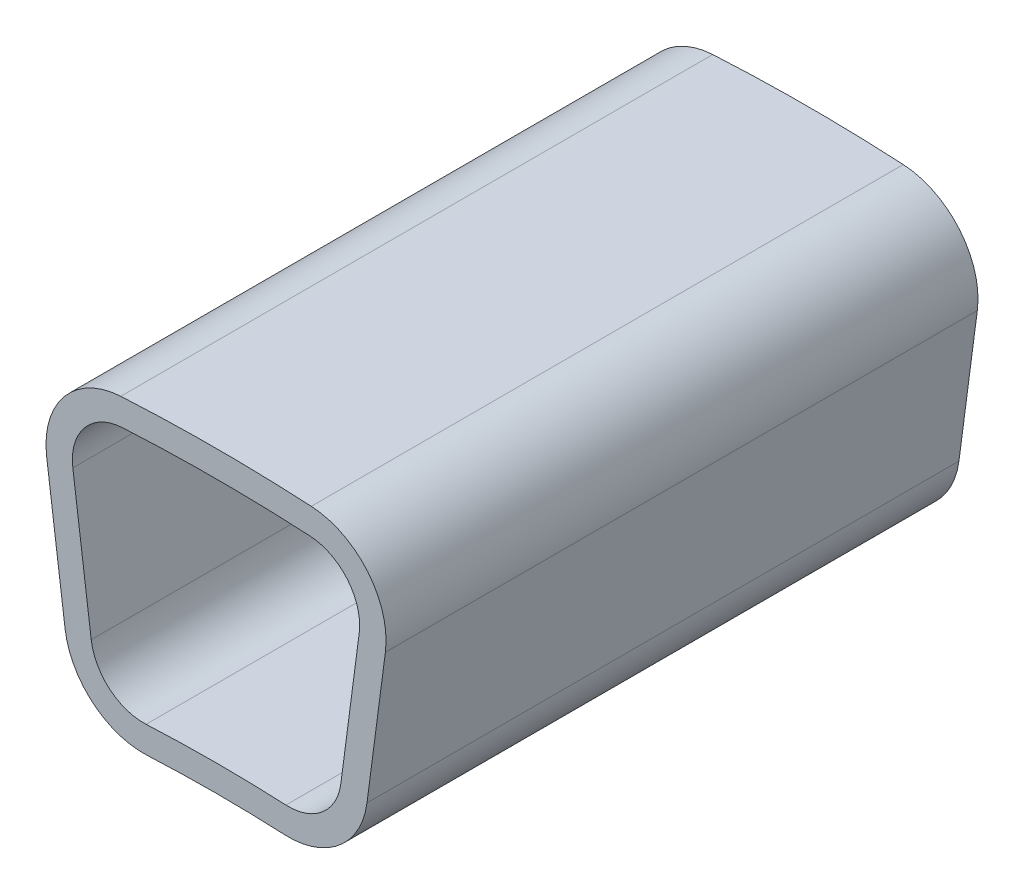
from build123d import *

# Parameters (mm, degrees)
BOSS_EXTRUDE1_DEPTH = 33.65


with BuildPart() as part:
    # Sketch1 → Boss-Extrude1 (new body)
    with BuildSketch(Plane.XY):
        with BuildLine():
            Line((8.581782676, 84.338354997), (9.626750626, 92.275674602))
            ThreePointArc((9.626750626, 92.275674602), (8.629643832, 95.734969819), (5.415162452, 97.356097457))
            ThreePointArc((5.415162452, 97.356097457), (0, 97.506582836), (-5.415162452, 97.356097457))
            ThreePointArc((-5.415162452, 97.356097457), (-8.629643832, 95.734969819), (-9.626750626, 92.275674602))
            Line((-9.626750626, 92.275674602), (-8.581782676, 84.338354997))
            ThreePointArc((-8.581782676, 84.338354997), (-7.004465647, 81.471525738), (-3.902214001, 80.431009648))
            ThreePointArc((-3.902214001, 80.431009648), (0, 80.525614479), (3.902214001, 80.431009648))
            ThreePointArc((3.902214001, 80.431009648), (7.004465647, 81.471525738), (8.581782676, 84.338354997))
        make_face()
        with BuildLine():
            Line((-8.139583334, 92.47146389), (-7.094615384, 84.534144285))
            ThreePointArc((-7.094615384, 84.534144285), (-6.043070698, 82.622924779), (-3.974902934, 81.929247386))
            ThreePointArc((-3.974902934, 81.929247386), (0, 82.025614479), (3.974902934, 81.929247386))
            ThreePointArc((3.974902934, 81.929247386), (6.043070698, 82.622924779), (7.094615384, 84.534144285))
            Line((7.094615384, 84.534144285), (8.139583334, 92.47146389))
            ThreePointArc((8.139583334, 92.47146389), (7.474845471, 94.777660702), (5.331857885, 95.85841246))
            ThreePointArc((5.331857885, 95.85841246), (0, 96.006582836), (-5.331857885, 95.85841246))
            ThreePointArc((-5.331857885, 95.85841246), (-7.474845471, 94.777660702), (-8.139583334, 92.47146389))
        make_face(mode=Mode.SUBTRACT)
    extrude(amount=BOSS_EXTRUDE1_DEPTH)


solid = part.part
